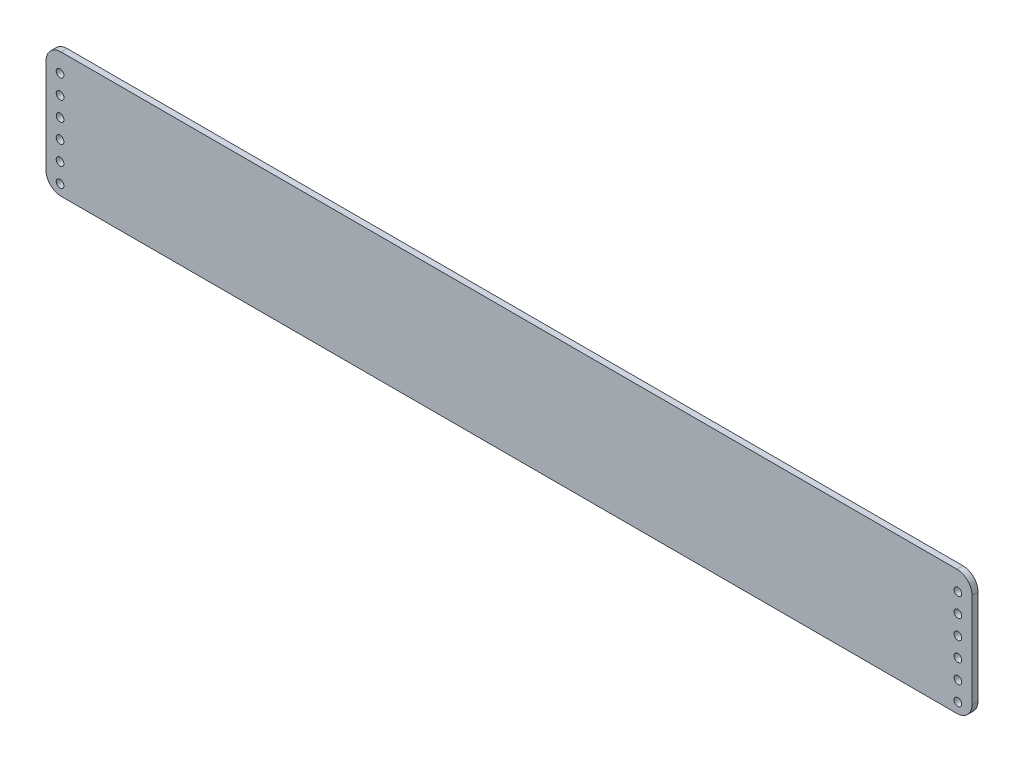
from build123d import *

# Parameters (mm, degrees)
SKETCH_1_W      = 615
SKETCH_1_H      = 83
SKETCH_1_R      = 2.555
EXTRUDE_1_DEPTH = 4
FILLET_1_R      = 10


with BuildPart() as part:
    # 草图1 → 凸台-拉伸1 (new body)
    with BuildSketch(Plane.XY):
        Rectangle(SKETCH_1_W, SKETCH_1_H)
        with Locations((-298.155, -34.6)):
            Circle(SKETCH_1_R, mode=Mode.SUBTRACT)
        with Locations((-298.155, -21.9)):
            Circle(SKETCH_1_R, mode=Mode.SUBTRACT)
        with Locations((-298.155, -9.2)):
            Circle(SKETCH_1_R, mode=Mode.SUBTRACT)
        with Locations((-298.155, 3.5)):
            Circle(SKETCH_1_R, mode=Mode.SUBTRACT)
        with Locations((-298.155, 16.2)):
            Circle(SKETCH_1_R, mode=Mode.SUBTRACT)
        with Locations(Location((298.155, 16.2, 0), (0, 0, 180))):
            Circle(SKETCH_1_R, mode=Mode.SUBTRACT)
        with Locations(Location((298.155, 3.5, 0), (0, 0, 180))):
            Circle(SKETCH_1_R, mode=Mode.SUBTRACT)
        with Locations(Location((298.155, -9.2, 0), (0, 0, 180))):
            Circle(SKETCH_1_R, mode=Mode.SUBTRACT)
        with Locations(Location((298.155, -21.9, 0), (0, 0, 180))):
            Circle(SKETCH_1_R, mode=Mode.SUBTRACT)
        with Locations(Location((298.155, -34.6, 0), (0, 0, 180))):
            Circle(SKETCH_1_R, mode=Mode.SUBTRACT)
        with Locations((-298.155, 28.9)):
            Circle(SKETCH_1_R, mode=Mode.SUBTRACT)
        with Locations(Location((298.155, 28.9, 0), (0, 0, 180))):
            Circle(SKETCH_1_R, mode=Mode.SUBTRACT)
    extrude(amount=EXTRUDE_1_DEPTH)

    # 圆角1
    fillet_1_edges = [part.edges().sort_by_distance(p)[0] for p in [
        (307.5, -41.5, 2),
        (-307.5, -41.5, 2),
        (-307.5, 41.5, 2),
        (307.5, 41.5, 2),
    ]]
    fillet(fillet_1_edges, radius=FILLET_1_R)


solid = part.part
